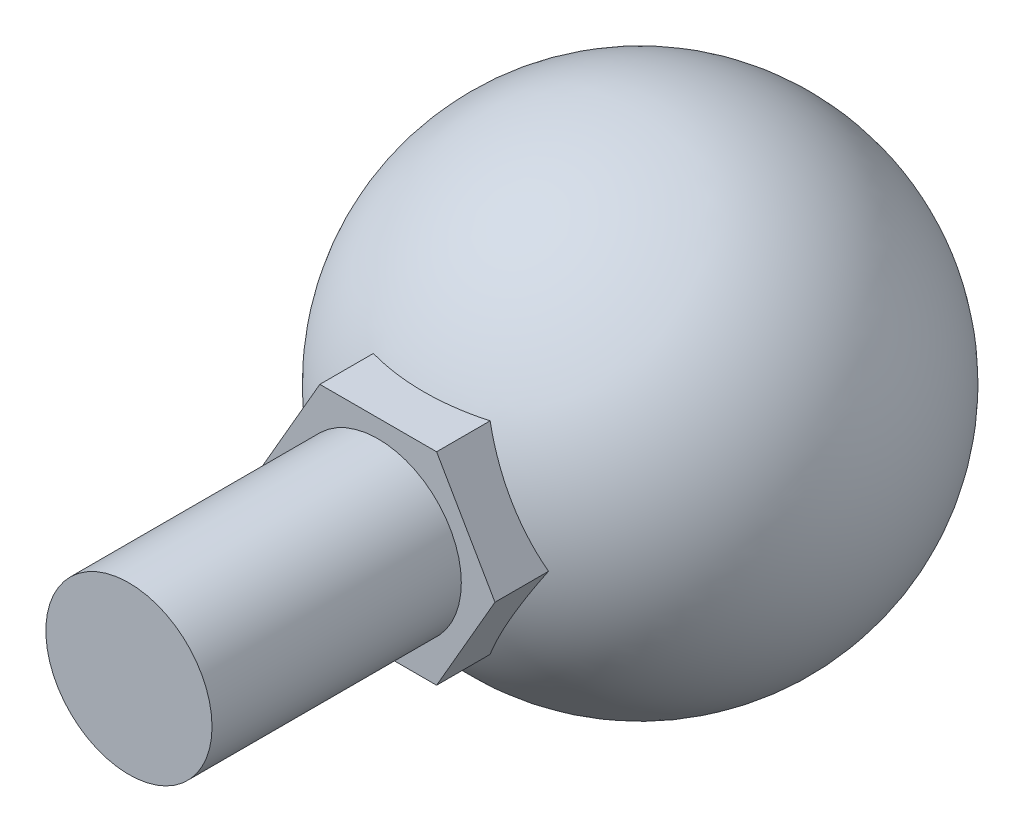
from build123d import *

# Parameters (mm, degrees)
SKETCH2_W           = 4
SKETCH2_H           = 15
BOSS_EXTRUDE1_DEPTH = 3


with BuildPart() as part:
    # Sketch1 → Revolve1 (revolve)
    with BuildSketch(Plane(origin=(0, 0, 0), x_dir=(1, 0, 0), z_dir=(0, 1, 0))):
        with BuildLine():
            Line((0, -11.5), (0, 11.5))
            ThreePointArc((0, 11.5), (-11.5, 0), (0, -11.5))
        make_face()
    revolve(axis=Axis((0, 0, 11.5), (0, 0, -1)))

    # Sketch2 → Revolve2 (revolve)
    with BuildSketch(Plane(origin=(0, 0, 0), x_dir=(1, 0, 0), z_dir=(0, 1, 0))):
        with Locations((-2, -17.110144679)):
            Rectangle(SKETCH2_W, SKETCH2_H)
    revolve(axis=Axis((0, 0, 24.610144679), (0, 0, -1)))

    # Sketch3 → Boss-Extrude1 (add)
    with BuildSketch(Plane.XY.offset(9.610144679)):
        Polygon((2.810278521, 4.867545181), (-2.810278521, 4.867545181), (-5.620557041, 0), (-2.810278521, -4.867545181), (2.810278521, -4.867545181), (5.620557041, 0), align=None)
    extrude(amount=BOSS_EXTRUDE1_DEPTH)


solid = part.part
